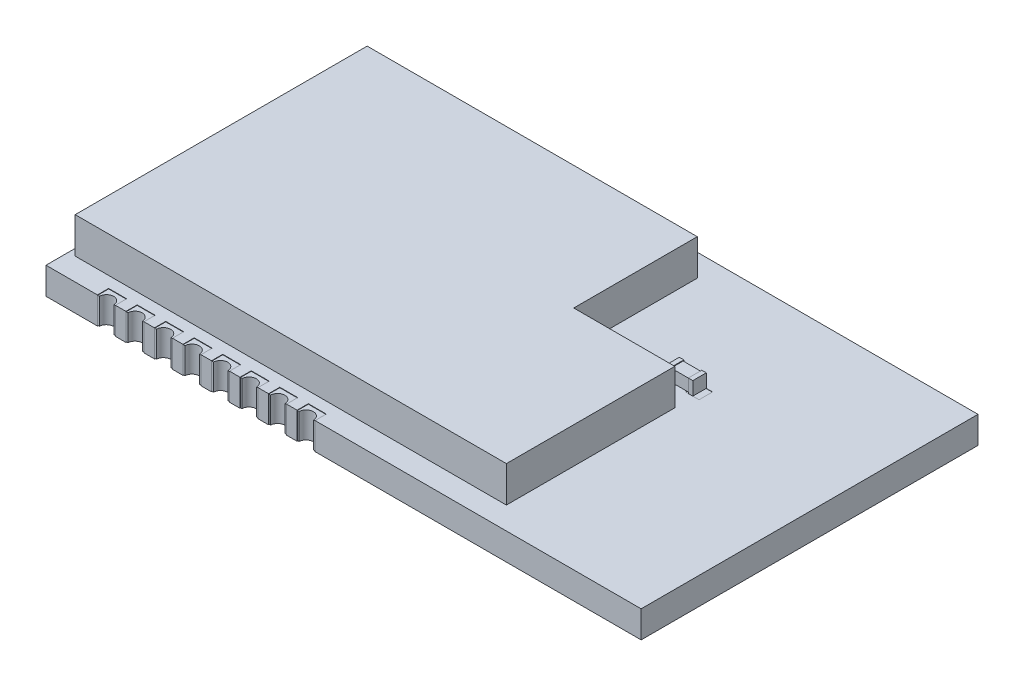
from build123d import *

# Parameters (mm, degrees)
SKETCH_1_W                        = 26.5
SKETCH_1_H                        = 15
EXTRUDE_1_DEPTH                   = 1.2
EXTRUDE_2_DEPTH                   = 1.6
CUT_EXTRUDE_1_DEPTH               = 1.6
SKETCH_4_W                        = 1.2
SKETCH_4_H                        = 0.6
EXTRUDE_3_DEPTH                   = 0.6
CUT_EXTRUDE_2_DEPTH               = 0.02
CUT_EXTRUDE_START                 = -0.02
CUT_EXTRUDE_3_DEPTH               = 0.02
SKETCH_8_W                        = 0.8
SKETCH_8_H                        = 1.2
CUT_EXTRUDE_4_DEPTH               = 0.01
PATTERN_LINEAR_1_COUNT            = 8
PATTERN_LINEAR_1_PITCH            = 1.27
PATTERN_LINEAR_1_COPY_1_DEPTH     = 0.02
PATTERN_LINEAR_1_COPY_2_DEPTH     = 0.02
PATTERN_LINEAR_1_COPY_3_DEPTH     = 0.02
PATTERN_LINEAR_1_COPY_4_DEPTH     = 0.02
PATTERN_LINEAR_1_COPY_5_DEPTH     = 0.02
PATTERN_LINEAR_1_COPY_6_DEPTH     = 0.02
PATTERN_LINEAR_1_COPY_7_DEPTH     = 0.02
PATTERN_START                     = -0.02
PATTERN_LINEAR_1_COPY_8_DEPTH     = 0.02
PATTERN_LINEAR_1_COPY_9_DEPTH     = 0.02
PATTERN_LINEAR_1_COPY_10_DEPTH    = 0.02
PATTERN_LINEAR_1_COPY_11_DEPTH    = 0.02
PATTERN_LINEAR_1_COPY_12_DEPTH    = 0.02
PATTERN_LINEAR_1_COPY_13_DEPTH    = 0.02
PATTERN_LINEAR_1_COPY_14_DEPTH    = 0.02
PATTERN_LINEAR_1_COPY_15_SKETCH_W = 0.8
PATTERN_LINEAR_1_COPY_15_SKETCH_H = 1.2
PATTERN_LINEAR_1_COPY_15_DEPTH    = 0.01
PATTERN_LINEAR_1_COPY_16_SKETCH_W = 0.8
PATTERN_LINEAR_1_COPY_16_SKETCH_H = 1.2
PATTERN_LINEAR_1_COPY_16_DEPTH    = 0.01
PATTERN_LINEAR_1_COPY_17_SKETCH_W = 0.8
PATTERN_LINEAR_1_COPY_17_SKETCH_H = 1.2
PATTERN_LINEAR_1_COPY_17_DEPTH    = 0.01
PATTERN_LINEAR_1_COPY_18_SKETCH_W = 0.8
PATTERN_LINEAR_1_COPY_18_SKETCH_H = 1.2
PATTERN_LINEAR_1_COPY_18_DEPTH    = 0.01
PATTERN_LINEAR_1_COPY_19_SKETCH_W = 0.8
PATTERN_LINEAR_1_COPY_19_SKETCH_H = 1.2
PATTERN_LINEAR_1_COPY_19_DEPTH    = 0.01
PATTERN_LINEAR_1_COPY_20_SKETCH_W = 0.8
PATTERN_LINEAR_1_COPY_20_SKETCH_H = 1.2
PATTERN_LINEAR_1_COPY_20_DEPTH    = 0.01
PATTERN_LINEAR_1_COPY_21_SKETCH_W = 0.8
PATTERN_LINEAR_1_COPY_21_SKETCH_H = 1.2
PATTERN_LINEAR_1_COPY_21_DEPTH    = 0.01
SKETCH_10_W                       = 0.6
SKETCH_10_H                       = 0.6
SKETCH_10_W_2                     = 0.735
CUT_EXTRUDE_5_DEPTH               = 0.01
SKETCH_11_W                       = 0.8
SKETCH_11_H                       = 0.6
CUT_EXTRUDE_6_DEPTH               = 0.03
PATTERN_CIRCULAR_1_COUNT          = 4


with BuildPart() as part:
    # 草图1 → 凸台-拉伸1 (new body)
    with BuildSketch(Plane(origin=(0, 0, 0), x_dir=(1, 0, 0), z_dir=(0, 1, 0))):
        with Locations((13.25, 7.5)):
            Rectangle(SKETCH_1_W, SKETCH_1_H)
    extrude(amount=EXTRUDE_1_DEPTH)

    # 草图2 → 凸台-拉伸2 (add)
    with BuildSketch(Plane(origin=(0, 1.2, 0), x_dir=(1, 0, 0), z_dir=(0, 1, 0))):
        Polygon((0.3, 1), (19.5, 1), (19.5, 8.5), (15, 8.5), (15, 14), (0.3, 14), align=None)
    extrude(amount=EXTRUDE_2_DEPTH)

    # 草图3 → 切除-拉伸1 (cut)
    with BuildSketch(Plane(origin=(0, 1.2, 0), x_dir=(1, 0, 0), z_dir=(0, 1, 0))):
        with BuildLine():
            Line((2.365, 0), (3.015, 0))
            ThreePointArc((3.015, 0), (2.69, 0.325), (2.365, 0))
        make_face()
        with BuildLine():
            Line((3.635, 0), (4.285, 0))
            ThreePointArc((4.285, 0), (3.96, 0.325), (3.635, 0))
        make_face()
        with BuildLine():
            Line((4.905, 0), (5.555, 0))
            ThreePointArc((5.555, 0), (5.23, 0.325), (4.905, 0))
        make_face()
        with BuildLine():
            Line((6.175, 0), (6.825, 0))
            ThreePointArc((6.825, 0), (6.5, 0.325), (6.175, 0))
        make_face()
        with BuildLine():
            Line((7.445, 0), (8.095, 0))
            ThreePointArc((8.095, 0), (7.77, 0.325), (7.445, 0))
        make_face()
        with BuildLine():
            Line((8.715, 0), (9.365, 0))
            ThreePointArc((9.365, 0), (9.04, 0.325), (8.715, 0))
        make_face()
        with BuildLine():
            Line((9.985, 0), (10.635, 0))
            ThreePointArc((10.635, 0), (10.31, 0.325), (9.985, 0))
        make_face()
        with BuildLine():
            Line((11.255, 0), (11.905, 0))
            ThreePointArc((11.905, 0), (11.58, 0.325), (11.255, 0))
        make_face()
    cut_extrude_1 = extrude(amount=-CUT_EXTRUDE_1_DEPTH, mode=Mode.SUBTRACT)

    # 镜向1: 切除-拉伸1 across plane
    add(cut_extrude_1.mirror(Plane(origin=(0, 0, -7.5), x_dir=(1, 0, 0), z_dir=(0, 0, -1))), mode=Mode.SUBTRACT)

    # 草图4 → 凸台-拉伸3 (add)
    with BuildSketch(Plane(origin=(0, 1.2, 0), x_dir=(1, 0, 0), z_dir=(0, 1, 0))):
        with Locations((18.85, 9.65)):
            Rectangle(SKETCH_4_W, SKETCH_4_H)
    extrude(amount=EXTRUDE_3_DEPTH)

    # 草图6 → 切除-拉伸2 (cut)
    with BuildSketch(Plane(origin=(0, 1.2, 0), x_dir=(1, 0, 0), z_dir=(0, 1, 0))):
        with BuildLine():
            Line((2.29, 0), (2.29, 0.5))
            Line((2.29, 0.5), (3.09, 0.5))
            Line((3.09, 0.5), (3.09, 0))
            Line((3.09, 0), (3.015, 0))
            ThreePointArc((3.015, 0), (2.69, 0.325), (2.365, 0))
            Line((2.365, 0), (2.29, 0))
        make_face()
    cut_extrude_2 = extrude(amount=-CUT_EXTRUDE_2_DEPTH, mode=Mode.SUBTRACT)

    # 草图9 → 切除-拉伸3 (cut)
    with BuildSketch(Plane.XZ.offset(CUT_EXTRUDE_START)):
        with BuildLine():
            Line((2.29, 0), (2.365, 0))
            ThreePointArc((2.365, 0), (2.69, -0.325), (3.015, 0))
            Line((3.015, 0), (3.09, 0))
            Line((3.09, 0), (3.09, -1))
            Line((3.09, -1), (2.29, -1))
            Line((2.29, -1), (2.29, 0))
        make_face()
    cut_extrude_3 = extrude(amount=CUT_EXTRUDE_3_DEPTH, mode=Mode.SUBTRACT)

    # 草图8 → 切除-拉伸4 (cut)
    with BuildSketch(Plane.XY):
        with Locations((2.69, 0.6)):
            Rectangle(SKETCH_8_W, SKETCH_8_H)
    cut_extrude_4 = extrude(amount=-CUT_EXTRUDE_4_DEPTH, mode=Mode.SUBTRACT)

    # 镜向2: 切除-拉伸2, 切除-拉伸3, 切除-拉伸4 across plane
    add(cut_extrude_2.mirror(Plane(origin=(0, 0, -7.5), x_dir=(1, 0, 0), z_dir=(0, 0, -1))), mode=Mode.SUBTRACT)
    add(cut_extrude_3.mirror(Plane(origin=(0, 0, -7.5), x_dir=(1, 0, 0), z_dir=(0, 0, -1))), mode=Mode.SUBTRACT)
    add(cut_extrude_4.mirror(Plane(origin=(0, 0, -7.5), x_dir=(1, 0, 0), z_dir=(0, 0, -1))), mode=Mode.SUBTRACT)

    # 阵列(线性)1: 切除-拉伸2, 切除-拉伸3, 切除-拉伸4 ×8
    with Locations(*[(i * PATTERN_LINEAR_1_PITCH, 0, 0) for i in range(1, PATTERN_LINEAR_1_COUNT)]):
        add(cut_extrude_2, mode=Mode.SUBTRACT)
        add(cut_extrude_3, mode=Mode.SUBTRACT)
        add(cut_extrude_4, mode=Mode.SUBTRACT)

    # 阵列(线性)1 copy 1 sketch → 阵列(线性)1 copy 1 (cut)
    with BuildSketch(Plane(origin=(1.27, 1.2, -15), x_dir=(1, 0, 0), z_dir=(0, 1, 0))):
        with BuildLine():
            Line((2.29, 0), (2.29, -0.5))
            Line((2.29, -0.5), (3.09, -0.5))
            Line((3.09, -0.5), (3.09, 0))
            Line((3.09, 0), (3.015, 0))
            ThreePointArc((3.015, 0), (2.69, -0.325), (2.365, 0))
            Line((2.365, 0), (2.29, 0))
        make_face()
    extrude(amount=-PATTERN_LINEAR_1_COPY_1_DEPTH, mode=Mode.SUBTRACT)

    # 阵列(线性)1 copy 2 sketch → 阵列(线性)1 copy 2 (cut)
    with BuildSketch(Plane(origin=(2.54, 1.2, -15), x_dir=(1, 0, 0), z_dir=(0, 1, 0))):
        with BuildLine():
            Line((2.29, 0), (2.29, -0.5))
            Line((2.29, -0.5), (3.09, -0.5))
            Line((3.09, -0.5), (3.09, 0))
            Line((3.09, 0), (3.015, 0))
            ThreePointArc((3.015, 0), (2.69, -0.325), (2.365, 0))
            Line((2.365, 0), (2.29, 0))
        make_face()
    extrude(amount=-PATTERN_LINEAR_1_COPY_2_DEPTH, mode=Mode.SUBTRACT)

    # 阵列(线性)1 copy 3 sketch → 阵列(线性)1 copy 3 (cut)
    with BuildSketch(Plane(origin=(3.81, 1.2, -15), x_dir=(1, 0, 0), z_dir=(0, 1, 0))):
        with BuildLine():
            Line((2.29, 0), (2.29, -0.5))
            Line((2.29, -0.5), (3.09, -0.5))
            Line((3.09, -0.5), (3.09, 0))
            Line((3.09, 0), (3.015, 0))
            ThreePointArc((3.015, 0), (2.69, -0.325), (2.365, 0))
            Line((2.365, 0), (2.29, 0))
        make_face()
    extrude(amount=-PATTERN_LINEAR_1_COPY_3_DEPTH, mode=Mode.SUBTRACT)

    # 阵列(线性)1 copy 4 sketch → 阵列(线性)1 copy 4 (cut)
    with BuildSketch(Plane(origin=(5.08, 1.2, -15), x_dir=(1, 0, 0), z_dir=(0, 1, 0))):
        with BuildLine():
            Line((2.29, 0), (2.29, -0.5))
            Line((2.29, -0.5), (3.09, -0.5))
            Line((3.09, -0.5), (3.09, 0))
            Line((3.09, 0), (3.015, 0))
            ThreePointArc((3.015, 0), (2.69, -0.325), (2.365, 0))
            Line((2.365, 0), (2.29, 0))
        make_face()
    extrude(amount=-PATTERN_LINEAR_1_COPY_4_DEPTH, mode=Mode.SUBTRACT)

    # 阵列(线性)1 copy 5 sketch → 阵列(线性)1 copy 5 (cut)
    with BuildSketch(Plane(origin=(6.35, 1.2, -15), x_dir=(1, 0, 0), z_dir=(0, 1, 0))):
        with BuildLine():
            Line((2.29, 0), (2.29, -0.5))
            Line((2.29, -0.5), (3.09, -0.5))
            Line((3.09, -0.5), (3.09, 0))
            Line((3.09, 0), (3.015, 0))
            ThreePointArc((3.015, 0), (2.69, -0.325), (2.365, 0))
            Line((2.365, 0), (2.29, 0))
        make_face()
    extrude(amount=-PATTERN_LINEAR_1_COPY_5_DEPTH, mode=Mode.SUBTRACT)

    # 阵列(线性)1 copy 6 sketch → 阵列(线性)1 copy 6 (cut)
    with BuildSketch(Plane(origin=(7.62, 1.2, -15), x_dir=(1, 0, 0), z_dir=(0, 1, 0))):
        with BuildLine():
            Line((2.29, 0), (2.29, -0.5))
            Line((2.29, -0.5), (3.09, -0.5))
            Line((3.09, -0.5), (3.09, 0))
            Line((3.09, 0), (3.015, 0))
            ThreePointArc((3.015, 0), (2.69, -0.325), (2.365, 0))
            Line((2.365, 0), (2.29, 0))
        make_face()
    extrude(amount=-PATTERN_LINEAR_1_COPY_6_DEPTH, mode=Mode.SUBTRACT)

    # 阵列(线性)1 copy 7 sketch → 阵列(线性)1 copy 7 (cut)
    with BuildSketch(Plane(origin=(8.89, 1.2, -15), x_dir=(1, 0, 0), z_dir=(0, 1, 0))):
        with BuildLine():
            Line((2.29, 0), (2.29, -0.5))
            Line((2.29, -0.5), (3.09, -0.5))
            Line((3.09, -0.5), (3.09, 0))
            Line((3.09, 0), (3.015, 0))
            ThreePointArc((3.015, 0), (2.69, -0.325), (2.365, 0))
            Line((2.365, 0), (2.29, 0))
        make_face()
    extrude(amount=-PATTERN_LINEAR_1_COPY_7_DEPTH, mode=Mode.SUBTRACT)

    # 阵列(线性)1 copy 8 sketch → 阵列(线性)1 copy 8 (cut)
    with BuildSketch(Plane(origin=(1.27, 0, -15), x_dir=(1, 0, 0), z_dir=(0, -1, 0)).offset(PATTERN_START)):
        with BuildLine():
            Line((2.29, 0), (2.365, 0))
            ThreePointArc((2.365, 0), (2.69, 0.325), (3.015, 0))
            Line((3.015, 0), (3.09, 0))
            Line((3.09, 0), (3.09, 1))
            Line((3.09, 1), (2.29, 1))
            Line((2.29, 1), (2.29, 0))
        make_face()
    extrude(amount=PATTERN_LINEAR_1_COPY_8_DEPTH, mode=Mode.SUBTRACT)

    # 阵列(线性)1 copy 9 sketch → 阵列(线性)1 copy 9 (cut)
    with BuildSketch(Plane(origin=(2.54, 0, -15), x_dir=(1, 0, 0), z_dir=(0, -1, 0)).offset(PATTERN_START)):
        with BuildLine():
            Line((2.29, 0), (2.365, 0))
            ThreePointArc((2.365, 0), (2.69, 0.325), (3.015, 0))
            Line((3.015, 0), (3.09, 0))
            Line((3.09, 0), (3.09, 1))
            Line((3.09, 1), (2.29, 1))
            Line((2.29, 1), (2.29, 0))
        make_face()
    extrude(amount=PATTERN_LINEAR_1_COPY_9_DEPTH, mode=Mode.SUBTRACT)

    # 阵列(线性)1 copy 10 sketch → 阵列(线性)1 copy 10 (cut)
    with BuildSketch(Plane(origin=(3.81, 0, -15), x_dir=(1, 0, 0), z_dir=(0, -1, 0)).offset(PATTERN_START)):
        with BuildLine():
            Line((2.29, 0), (2.365, 0))
            ThreePointArc((2.365, 0), (2.69, 0.325), (3.015, 0))
            Line((3.015, 0), (3.09, 0))
            Line((3.09, 0), (3.09, 1))
            Line((3.09, 1), (2.29, 1))
            Line((2.29, 1), (2.29, 0))
        make_face()
    extrude(amount=PATTERN_LINEAR_1_COPY_10_DEPTH, mode=Mode.SUBTRACT)

    # 阵列(线性)1 copy 11 sketch → 阵列(线性)1 copy 11 (cut)
    with BuildSketch(Plane(origin=(5.08, 0, -15), x_dir=(1, 0, 0), z_dir=(0, -1, 0)).offset(PATTERN_START)):
        with BuildLine():
            Line((2.29, 0), (2.365, 0))
            ThreePointArc((2.365, 0), (2.69, 0.325), (3.015, 0))
            Line((3.015, 0), (3.09, 0))
            Line((3.09, 0), (3.09, 1))
            Line((3.09, 1), (2.29, 1))
            Line((2.29, 1), (2.29, 0))
        make_face()
    extrude(amount=PATTERN_LINEAR_1_COPY_11_DEPTH, mode=Mode.SUBTRACT)

    # 阵列(线性)1 copy 12 sketch → 阵列(线性)1 copy 12 (cut)
    with BuildSketch(Plane(origin=(6.35, 0, -15), x_dir=(1, 0, 0), z_dir=(0, -1, 0)).offset(PATTERN_START)):
        with BuildLine():
            Line((2.29, 0), (2.365, 0))
            ThreePointArc((2.365, 0), (2.69, 0.325), (3.015, 0))
            Line((3.015, 0), (3.09, 0))
            Line((3.09, 0), (3.09, 1))
            Line((3.09, 1), (2.29, 1))
            Line((2.29, 1), (2.29, 0))
        make_face()
    extrude(amount=PATTERN_LINEAR_1_COPY_12_DEPTH, mode=Mode.SUBTRACT)

    # 阵列(线性)1 copy 13 sketch → 阵列(线性)1 copy 13 (cut)
    with BuildSketch(Plane(origin=(7.62, 0, -15), x_dir=(1, 0, 0), z_dir=(0, -1, 0)).offset(PATTERN_START)):
        with BuildLine():
            Line((2.29, 0), (2.365, 0))
            ThreePointArc((2.365, 0), (2.69, 0.325), (3.015, 0))
            Line((3.015, 0), (3.09, 0))
            Line((3.09, 0), (3.09, 1))
            Line((3.09, 1), (2.29, 1))
            Line((2.29, 1), (2.29, 0))
        make_face()
    extrude(amount=PATTERN_LINEAR_1_COPY_13_DEPTH, mode=Mode.SUBTRACT)

    # 阵列(线性)1 copy 14 sketch → 阵列(线性)1 copy 14 (cut)
    with BuildSketch(Plane(origin=(8.89, 0, -15), x_dir=(1, 0, 0), z_dir=(0, -1, 0)).offset(PATTERN_START)):
        with BuildLine():
            Line((2.29, 0), (2.365, 0))
            ThreePointArc((2.365, 0), (2.69, 0.325), (3.015, 0))
            Line((3.015, 0), (3.09, 0))
            Line((3.09, 0), (3.09, 1))
            Line((3.09, 1), (2.29, 1))
            Line((2.29, 1), (2.29, 0))
        make_face()
    extrude(amount=PATTERN_LINEAR_1_COPY_14_DEPTH, mode=Mode.SUBTRACT)

    # 阵列(线性)1 copy 15 sketch → 阵列(线性)1 copy 15 (cut)
    with BuildSketch(Plane(origin=(1.27, 0, -15), x_dir=(1, 0, 0), z_dir=(0, 0, -1))):
        with Locations((2.69, -0.6)):
            Rectangle(PATTERN_LINEAR_1_COPY_15_SKETCH_W, PATTERN_LINEAR_1_COPY_15_SKETCH_H)
    extrude(amount=-PATTERN_LINEAR_1_COPY_15_DEPTH, mode=Mode.SUBTRACT)

    # 阵列(线性)1 copy 16 sketch → 阵列(线性)1 copy 16 (cut)
    with BuildSketch(Plane(origin=(2.54, 0, -15), x_dir=(1, 0, 0), z_dir=(0, 0, -1))):
        with Locations((2.69, -0.6)):
            Rectangle(PATTERN_LINEAR_1_COPY_16_SKETCH_W, PATTERN_LINEAR_1_COPY_16_SKETCH_H)
    extrude(amount=-PATTERN_LINEAR_1_COPY_16_DEPTH, mode=Mode.SUBTRACT)

    # 阵列(线性)1 copy 17 sketch → 阵列(线性)1 copy 17 (cut)
    with BuildSketch(Plane(origin=(3.81, 0, -15), x_dir=(1, 0, 0), z_dir=(0, 0, -1))):
        with Locations((2.69, -0.6)):
            Rectangle(PATTERN_LINEAR_1_COPY_17_SKETCH_W, PATTERN_LINEAR_1_COPY_17_SKETCH_H)
    extrude(amount=-PATTERN_LINEAR_1_COPY_17_DEPTH, mode=Mode.SUBTRACT)

    # 阵列(线性)1 copy 18 sketch → 阵列(线性)1 copy 18 (cut)
    with BuildSketch(Plane(origin=(5.08, 0, -15), x_dir=(1, 0, 0), z_dir=(0, 0, -1))):
        with Locations((2.69, -0.6)):
            Rectangle(PATTERN_LINEAR_1_COPY_18_SKETCH_W, PATTERN_LINEAR_1_COPY_18_SKETCH_H)
    extrude(amount=-PATTERN_LINEAR_1_COPY_18_DEPTH, mode=Mode.SUBTRACT)

    # 阵列(线性)1 copy 19 sketch → 阵列(线性)1 copy 19 (cut)
    with BuildSketch(Plane(origin=(6.35, 0, -15), x_dir=(1, 0, 0), z_dir=(0, 0, -1))):
        with Locations((2.69, -0.6)):
            Rectangle(PATTERN_LINEAR_1_COPY_19_SKETCH_W, PATTERN_LINEAR_1_COPY_19_SKETCH_H)
    extrude(amount=-PATTERN_LINEAR_1_COPY_19_DEPTH, mode=Mode.SUBTRACT)

    # 阵列(线性)1 copy 20 sketch → 阵列(线性)1 copy 20 (cut)
    with BuildSketch(Plane(origin=(7.62, 0, -15), x_dir=(1, 0, 0), z_dir=(0, 0, -1))):
        with Locations((2.69, -0.6)):
            Rectangle(PATTERN_LINEAR_1_COPY_20_SKETCH_W, PATTERN_LINEAR_1_COPY_20_SKETCH_H)
    extrude(amount=-PATTERN_LINEAR_1_COPY_20_DEPTH, mode=Mode.SUBTRACT)

    # 阵列(线性)1 copy 21 sketch → 阵列(线性)1 copy 21 (cut)
    with BuildSketch(Plane(origin=(8.89, 0, -15), x_dir=(1, 0, 0), z_dir=(0, 0, -1))):
        with Locations((2.69, -0.6)):
            Rectangle(PATTERN_LINEAR_1_COPY_21_SKETCH_W, PATTERN_LINEAR_1_COPY_21_SKETCH_H)
    extrude(amount=-PATTERN_LINEAR_1_COPY_21_DEPTH, mode=Mode.SUBTRACT)

    # 草图10 → 切除-拉伸5 (cut)
    with BuildSketch(Plane(origin=(0, 1.2, 0), x_dir=(1, 0, 0), z_dir=(0, 1, 0))):
        with Locations((17.2801, 9.6514)):
            Rectangle(SKETCH_10_W, SKETCH_10_H)
        with Locations((18.2862, 9.6514)):
            Rectangle(SKETCH_10_W_2, SKETCH_10_H)
        with Locations((19.4274, 9.6514)):
            Rectangle(SKETCH_10_W, SKETCH_10_H)
    extrude(amount=-CUT_EXTRUDE_5_DEPTH, mode=Mode.SUBTRACT)

    # 草图11 → 切除-拉伸6 (cut)
    with BuildSketch(Plane(origin=(0, 1.8, 0), x_dir=(1, 0, 0), z_dir=(0, 1, 0))):
        with Locations((18.85, 9.65)):
            Rectangle(SKETCH_11_W, SKETCH_11_H)
    cut_extrude_6 = extrude(amount=-CUT_EXTRUDE_6_DEPTH, mode=Mode.SUBTRACT)

    # 阵列(圆周)1: 切除-拉伸6 ×4 about axis
    pattern_circular_1_axis = Axis((18.25, 1.5, -9.65), (1, 0, 0))
    for i in range(1, PATTERN_CIRCULAR_1_COUNT):
        add(cut_extrude_6.rotate(pattern_circular_1_axis, i * 360 / PATTERN_CIRCULAR_1_COUNT), mode=Mode.SUBTRACT)


solid = part.part
